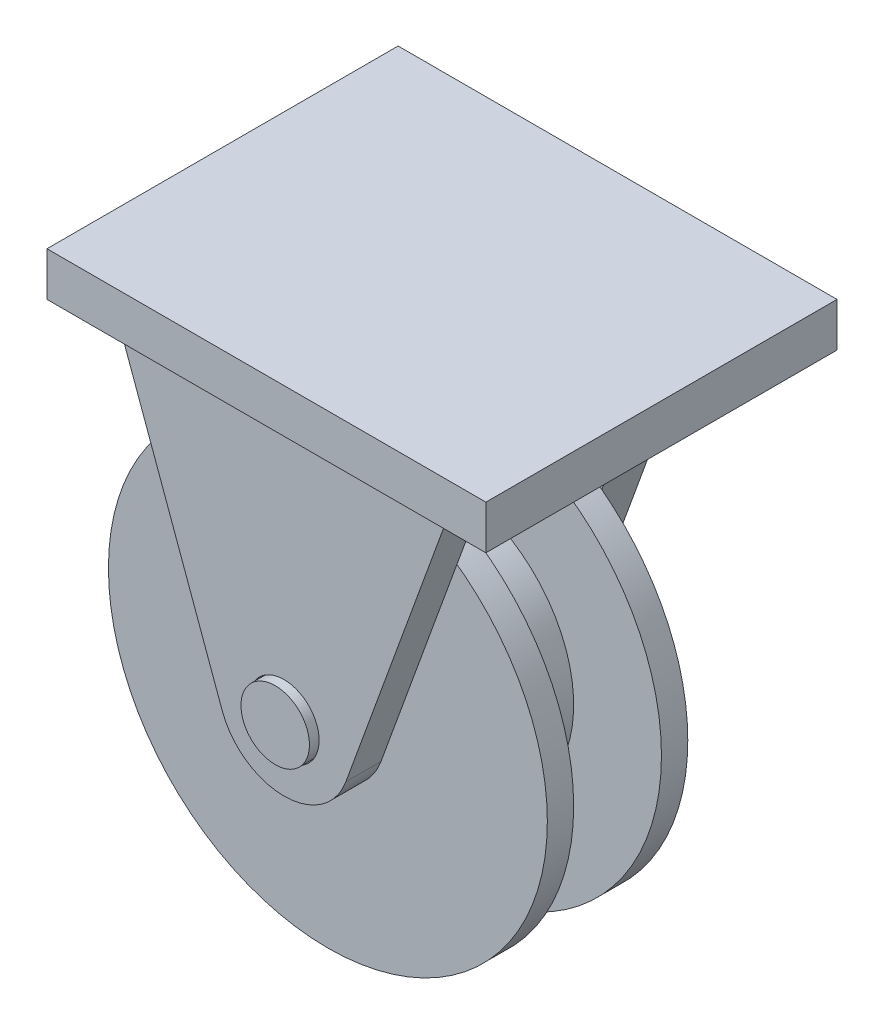
from build123d import *

# Parameters (mm, degrees)
SKETCH_1_R          = 25
EXTRUDE_1_DEPTH     = 3
SKETCH_2_R          = 4
EXTRUDE_2_DEPTH     = 5
SKETCH_3_R          = 3.9
EXTRUDE_4_DEPTH     = 6
SKETCH_5_R          = 15
EXTRUDE_5_DEPTH     = 10
EXTRUDE_START       = 6
SKETCH_6_R          = 3.9
EXTRUDE_6_DEPTH     = 6
SKETCH_8_W          = 50
SKETCH_8_H          = 40
EXTRUDE_7_DEPTH     = 5
SKETCH_2_3_R        = 4
CUT_EXTRUDE_1_DEPTH = 1


with BuildPart() as part:
    # 草图1 → 凸台-拉伸1 (new body)
    with BuildSketch(Plane.XY):
        Circle(SKETCH_1_R)
    extrude_1 = extrude(amount=EXTRUDE_1_DEPTH)

    # 草图2 → 凸台-拉伸2 (add)
    with BuildSketch(Plane.XY.offset(3)):
        with BuildLine():
            Line((-18.900440322, 30), (-7.047694656, -2.565151075))
            ThreePointArc((-7.047694656, -2.565151075), (0, -7.5), (7.047694656, -2.565151075))
            Line((7.047694656, -2.565151075), (18.900440322, 30))
            Line((18.900440322, 30), (-18.900440322, 30))
        make_face()
        Circle(SKETCH_2_R, mode=Mode.SUBTRACT)
    extrude_2 = extrude(amount=EXTRUDE_2_DEPTH)

    # 草图3 → 凸台-拉伸4 (add)
    with BuildSketch(Plane.XY.offset(3)):
        Circle(SKETCH_3_R)
    extrude(amount=EXTRUDE_4_DEPTH)

    # 草图5 → 凸台-拉伸5 (add)
    with BuildSketch(Plane(origin=(0, 0, 0), x_dir=(-1, 0, 0), z_dir=(0, 0, -1))):
        Circle(SKETCH_5_R)
    extrude(amount=EXTRUDE_5_DEPTH)

    # 镜向1: 凸台-拉伸1, 凸台-拉伸2 across plane
    add(extrude_1.mirror(Plane.XY.offset(-5)))
    add(extrude_2.mirror(Plane.XY.offset(-5)))

    # 草图6 → 凸台-拉伸6 (add)
    with BuildSketch(Plane(origin=(0, 0, -13), x_dir=(-1, 0, 0), z_dir=(0, 0, -1)).offset(EXTRUDE_START)):
        Circle(SKETCH_6_R)
    extrude(amount=-EXTRUDE_6_DEPTH)

    # 草图8 → 凸台-拉伸7 (add)
    with BuildSketch(Plane(origin=(0, 30, 0), x_dir=(1, 0, 0), z_dir=(0, 1, 0))):
        with Locations((0, 10)):
            Rectangle(SKETCH_8_W, SKETCH_8_H)
    extrude(amount=EXTRUDE_7_DEPTH)

    # 草图2<3> → 切除-拉伸1 (cut)
    with BuildSketch(Plane.XY.offset(3)):
        with BuildLine():
            Line((-18.900440322, 30), (-7.047694656, -2.565151075))
            ThreePointArc((-7.047694656, -2.565151075), (0, -7.5), (7.047694656, -2.565151075))
            Line((7.047694656, -2.565151075), (18.900440322, 30))
            Line((18.900440322, 30), (-18.900440322, 30))
        make_face()
        Circle(SKETCH_2_3_R, mode=Mode.SUBTRACT)
    extrude(amount=CUT_EXTRUDE_1_DEPTH, mode=Mode.SUBTRACT)


solid = part.part
